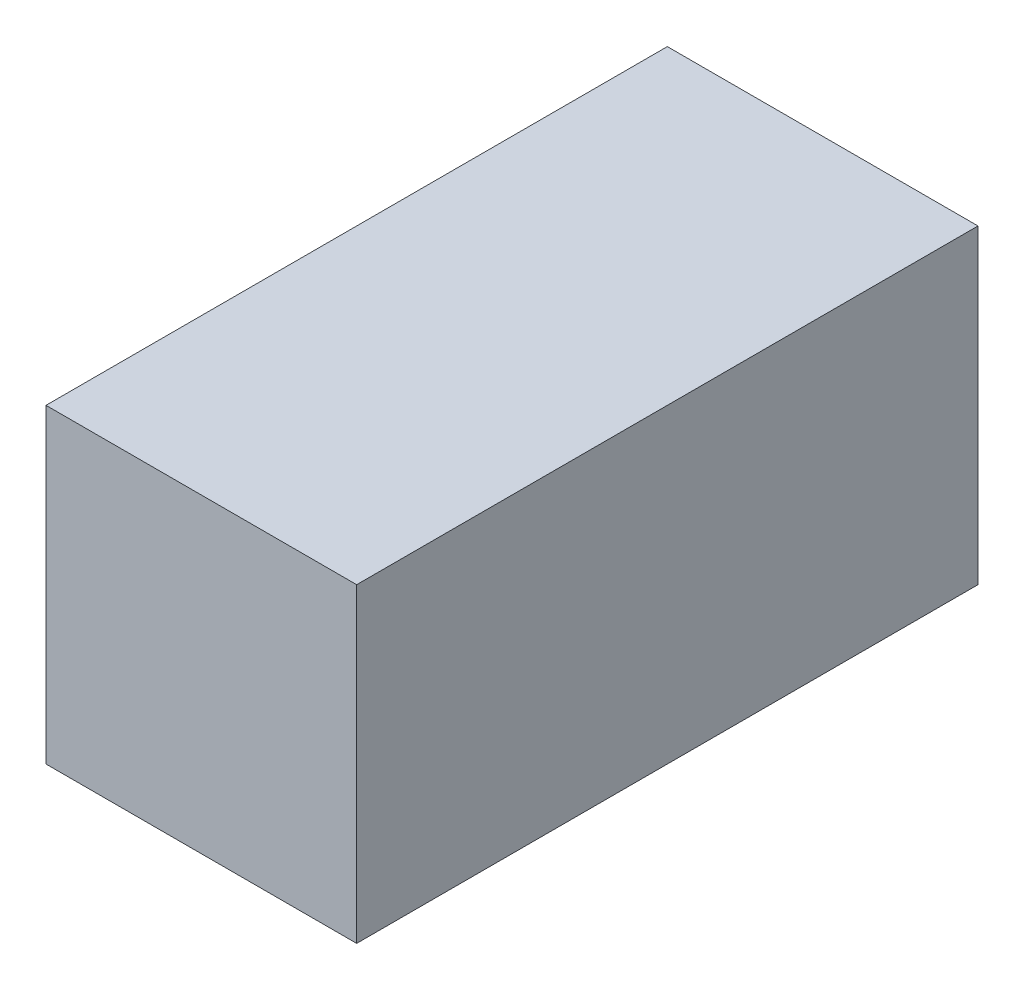
from build123d import *

# Parameters (mm, degrees)
SKETCH1_W           = 150
SKETCH1_H           = 150
BOSS_EXTRUDE1_DEPTH = 150


with BuildPart() as part:
    # Sketch1 → Boss-Extrude1 (new, symmetric)
    with BuildSketch(Plane.XY):
        Rectangle(SKETCH1_W, SKETCH1_H)
    extrude(amount=BOSS_EXTRUDE1_DEPTH, both=True)


solid = part.part
